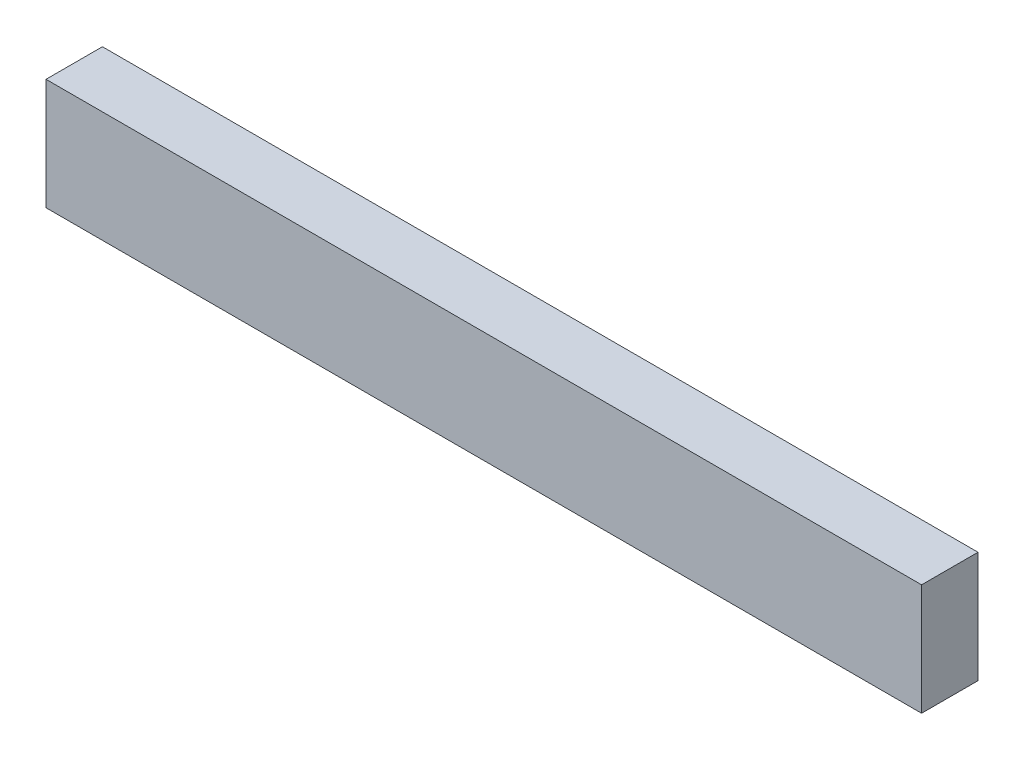
from build123d import *

# Parameters (mm, degrees)
SKICA1_W                = 38.8
SKICA1_H                = 4.93
P_IDAT_VYSUNUT_M1_DEPTH = 2.5


with BuildPart() as part:
    # Skica1 → Přidat vysunutím1 (new body)
    with BuildSketch(Plane.XY):
        Rectangle(SKICA1_W, SKICA1_H)
    extrude(amount=P_IDAT_VYSUNUT_M1_DEPTH)


solid = part.part
